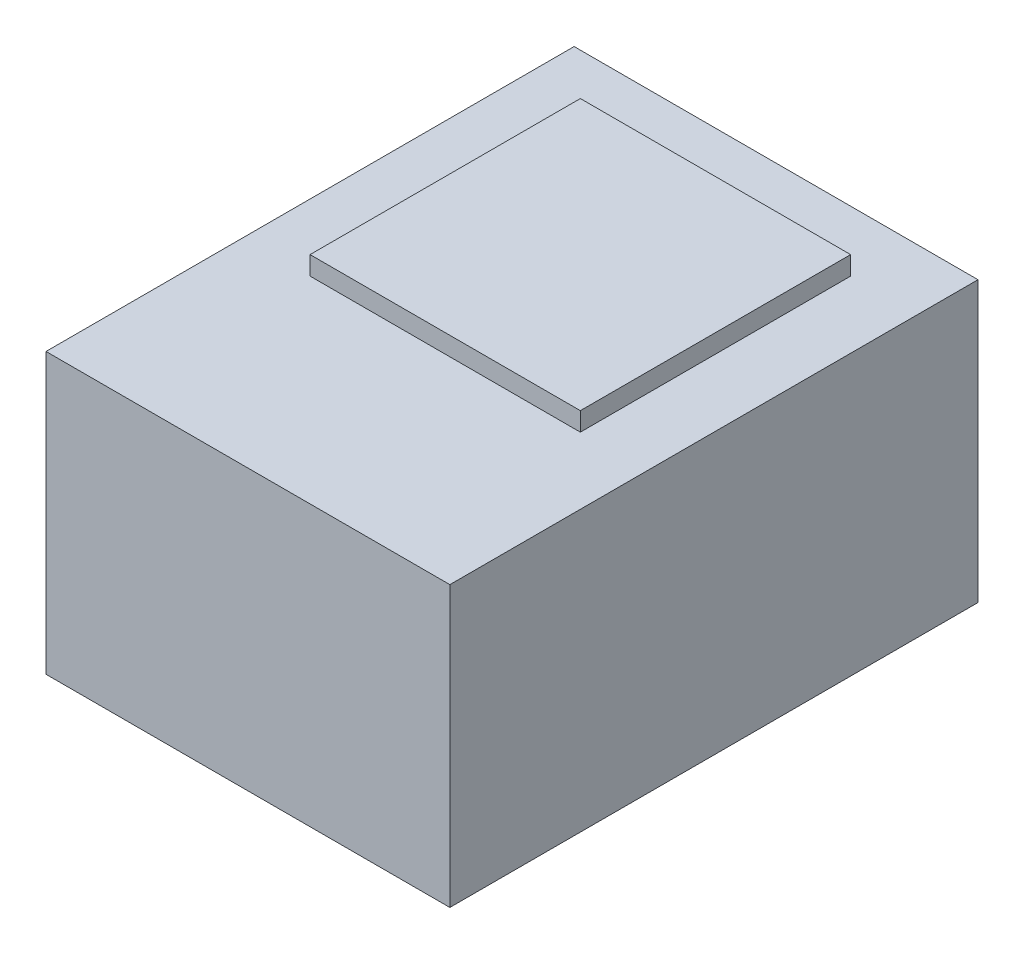
from build123d import *

# Parameters (mm, degrees)
SKETCH1_W           = 1.3
SKETCH1_H           = 1.7
BOSS_EXTRUDE1_DEPTH = 0.9
SKETCH2_W           = 0.4
SKETCH2_H           = 1.5
BOSS_EXTRUDE2_DEPTH = 0.06
SKETCH3_W           = 0.87
SKETCH3_H           = 0.87
BOSS_EXTRUDE3_DEPTH = 0.06


with BuildPart() as part:
    # Sketch1 → Boss-Extrude1 (new body)
    with BuildSketch(Plane(origin=(0, 0, 0), x_dir=(1, 0, 0), z_dir=(0, 1, 0))):
        Rectangle(SKETCH1_W, SKETCH1_H)
    extrude(amount=BOSS_EXTRUDE1_DEPTH)

    # Sketch2 → Boss-Extrude2 (add)
    with BuildSketch(Plane.XZ):
        with Locations((-0.325, 0.036372602)):
            Rectangle(SKETCH2_W, SKETCH2_H)
        with Locations((0.325, 0.036372602)):
            Rectangle(SKETCH2_W, SKETCH2_H)
    extrude(amount=BOSS_EXTRUDE2_DEPTH)

    # Sketch3 → Boss-Extrude3 (add)
    with BuildSketch(Plane(origin=(0, 0.9, 0), x_dir=(1, 0, 0), z_dir=(0, 1, 0))):
        with Locations((0, 0.22)):
            Rectangle(SKETCH3_W, SKETCH3_H)
    extrude(amount=BOSS_EXTRUDE3_DEPTH)


solid = part.part
